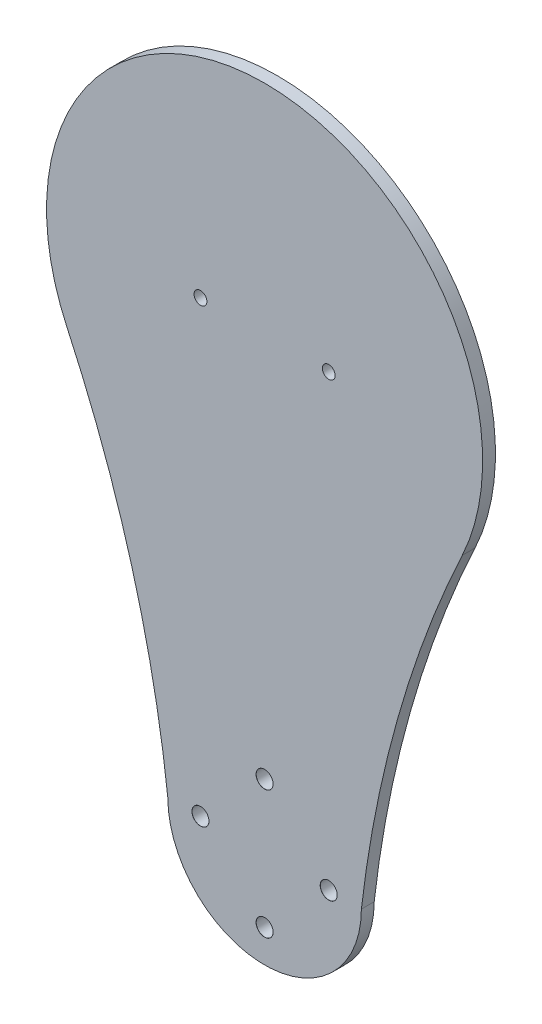
from build123d import *

# Parameters (mm, degrees)
BOSS_EXTRUDE4_DEPTH            = 5
M6_CLEARANCE_HOLE1_D           = 6.6
M6_CLEARANCE_HOLE1_CSINK_D     = 6.65
M6_CLEARANCE_HOLE1_CSINK_ANGLE = 90
SKETCH10_R                     = 2.5
CUT_EXTRUDE1_DEPTH             = 5


with BuildPart() as part:
    # Sketch6 → Boss-Extrude4 (new body)
    with BuildSketch(Plane.XY):
        with BuildLine():
            ThreePointArc((37.730032203, 0), (51.79672204, 71.134128832), (77.049643457, 139.106373223))
            ThreePointArc((77.049643457, 139.106373223), (0, 260), (-77.049643457, 139.106373223))
            ThreePointArc((-77.049643457, 139.106373223), (-51.79672204, 71.134128832), (-37.730032203, 0))
            ThreePointArc((-37.730032203, 0), (0, -37.730032203), (37.730032203, 0))
        make_face()
    extrude(amount=BOSS_EXTRUDE4_DEPTH)

    # M6 Clearance Hole1 (through all)
    with Locations(Plane.XY.offset(5)):
        with Locations((0, 25), (25, 0), (0, -25), (-25, 0)):
            CounterSinkHole(M6_CLEARANCE_HOLE1_D / 2, M6_CLEARANCE_HOLE1_CSINK_D / 2, counter_sink_angle=M6_CLEARANCE_HOLE1_CSINK_ANGLE)

    # Sketch10 → Cut-Extrude1 (cut)
    with BuildSketch(Plane.XY.offset(5)):
        with Locations((-25, 175)):
            Circle(SKETCH10_R)
        with Locations((25, 175)):
            Circle(SKETCH10_R)
    extrude(amount=-CUT_EXTRUDE1_DEPTH, mode=Mode.SUBTRACT)


solid = part.part
